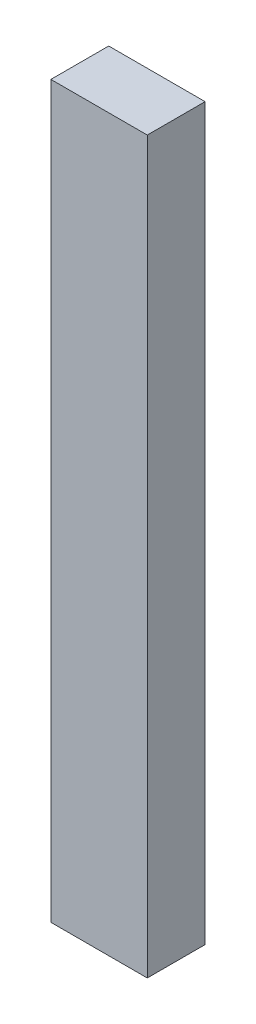
from build123d import *

# Parameters (mm, degrees)
SKETCH1_W           = 63.5
SKETCH1_H           = 480.95
BOSS_EXTRUDE1_DEPTH = 38.1


with BuildPart() as part:
    # Sketch1 → Boss-Extrude1 (new body)
    with BuildSketch(Plane.XY):
        with Locations((31.75, 240.475)):
            Rectangle(SKETCH1_W, SKETCH1_H)
    extrude(amount=BOSS_EXTRUDE1_DEPTH)


solid = part.part
